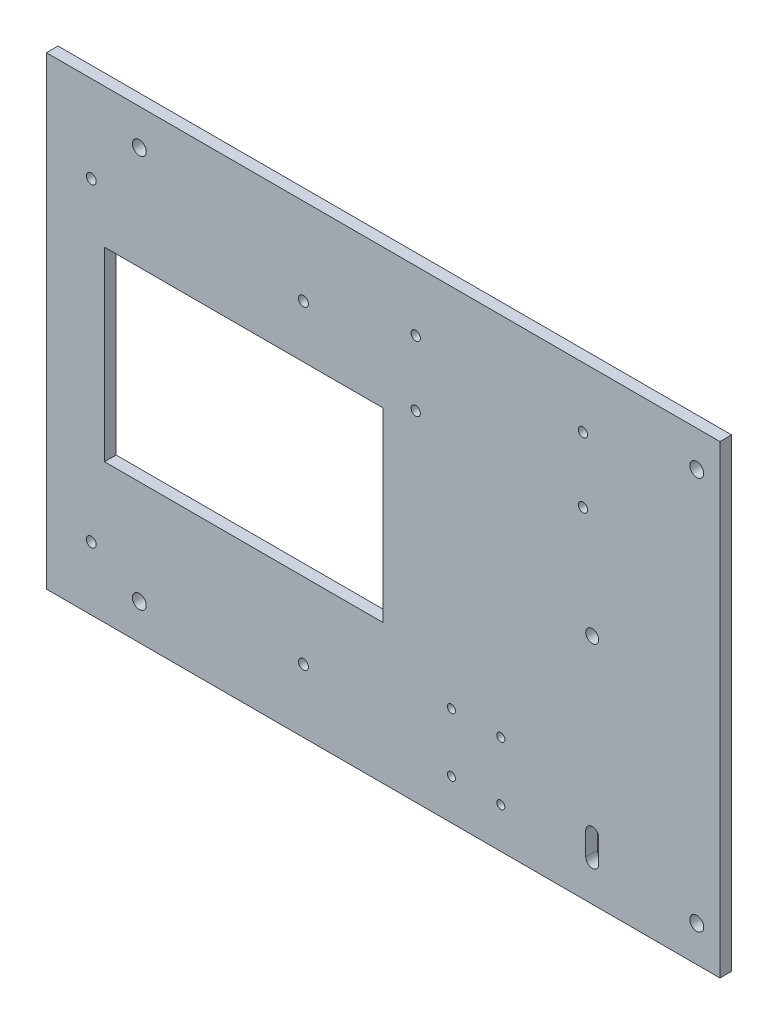
from build123d import *

# Parameters (mm, degrees)
SKETCH1_W             = 184.15
SKETCH1_H             = 127
BOSS_EXTRUDE1_DEPTH   = 3.175
SKETCH3_R             = 1.35
CUT_EXTRUDE1_DEPTH    = 112.893414686
F_6_CLEARANCE_HOLE1_D = 3.7973
SKETCH9_R             = 1.0999978
CUT_EXTRUDE2_DEPTH    = 112.893414686
SKETCH10_R            = 1.27
CUT_EXTRUDE3_DEPTH    = 112.893414686
SKETCH11_R            = 1.778
CUT_EXTRUDE4_DEPTH    = 112.893414686
SKETCH12_W            = 76.2
SKETCH12_H            = 50.8
CUT_EXTRUDE5_DEPTH    = 112.893414686


with BuildPart() as part:
    # Sketch1 → Boss-Extrude1 (new body)
    with BuildSketch(Plane.XY):
        Rectangle(SKETCH1_W, SKETCH1_H)
    extrude(amount=BOSS_EXTRUDE1_DEPTH)

    # Sketch3 → Cut-Extrude1 (cut, through all)
    with BuildSketch(Plane.XY.offset(3.175)):
        with Locations((-79.800000039, 39.825)):
            Circle(SKETCH3_R)
        with Locations((-21.799999961, 39.825)):
            Circle(SKETCH3_R)
        with Locations((-79.800000039, -46.175)):
            Circle(SKETCH3_R)
        with Locations((-21.799999961, -46.175)):
            Circle(SKETCH3_R)
    extrude(amount=-CUT_EXTRUDE1_DEPTH, mode=Mode.SUBTRACT)

    # #6 Clearance Hole1 (through all)
    with Locations(Plane.XY.offset(3.175)):
        with Locations((-66.675, 53.721), (85.725, 53.721)):
            f_6_clearance_hole1 = Hole(F_6_CLEARANCE_HOLE1_D / 2)

    # Mirror3: #6 Clearance Hole1 across plane
    add(f_6_clearance_hole1.mirror(Plane.ZX), mode=Mode.SUBTRACT)

    # Sketch9 → Cut-Extrude2 (cut, through all)
    with BuildSketch(Plane.XY.offset(3.175)):
        with Locations((18.650000038, -36.45)):
            Circle(SKETCH9_R)
        with Locations((32.149999962, -36.45)):
            Circle(SKETCH9_R)
        with Locations((32.149999962, -52.45)):
            Circle(SKETCH9_R)
        with Locations((18.650000038, -52.45)):
            Circle(SKETCH9_R)
    extrude(amount=-CUT_EXTRUDE2_DEPTH, mode=Mode.SUBTRACT)

    # Sketch10 → Cut-Extrude3 (cut, through all)
    with BuildSketch(Plane.XY.offset(3.175)):
        with Locations((54.61, 46.99)):
            Circle(SKETCH10_R)
        with Locations((54.61, 29.21)):
            Circle(SKETCH10_R)
        with Locations((8.89, 29.21)):
            Circle(SKETCH10_R)
        with Locations((8.89, 46.99)):
            Circle(SKETCH10_R)
    extrude(amount=-CUT_EXTRUDE3_DEPTH, mode=Mode.SUBTRACT)

    # Sketch11 → Cut-Extrude4 (cut, through all)
    with BuildSketch(Plane.XY.offset(3.175)):
        with Locations((57.15, 0)):
            Circle(SKETCH11_R)
        with BuildLine():
            Line((58.928, -46.863), (58.928, -53.213))
            ThreePointArc((58.928, -53.213), (57.15, -54.991), (55.372, -53.213))
            Line((55.372, -53.213), (55.372, -46.863))
            ThreePointArc((55.372, -46.863), (57.15, -45.085), (58.928, -46.863))
        make_face()
    extrude(amount=-CUT_EXTRUDE4_DEPTH, mode=Mode.SUBTRACT)

    # Sketch12 → Cut-Extrude5 (cut, through all)
    with BuildSketch(Plane.XY.offset(3.175)):
        with Locations((-38.1, 0)):
            Rectangle(SKETCH12_W, SKETCH12_H)
    extrude(amount=-CUT_EXTRUDE5_DEPTH, mode=Mode.SUBTRACT)


solid = part.part
